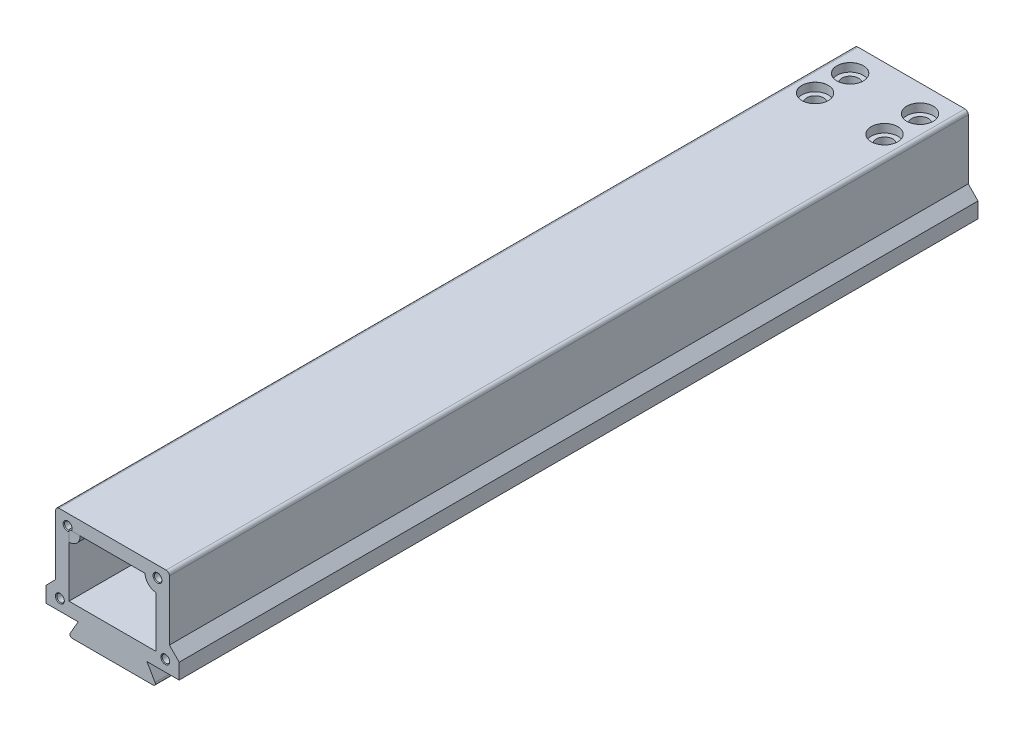
from build123d import *

# Parameters (mm, degrees)
BOSS_EXTRUDE1_DEPTH                     = 720
SKETCH2_W                               = 80.883152422
SKETCH2_H                               = 15.6
CUT_EXTRUDE1_DEPTH                      = 80
CBORE_FOR_M12_HEX_HEAD_BOLT1_AT_2_COUNT = 2
CBORE_FOR_M12_HEX_HEAD_BOLT1_AT_2_PITCH = 63
CBORE_FOR_M12_HEX_HEAD_BOLT2_AT_2_COUNT = 2
CBORE_FOR_M12_HEX_HEAD_BOLT2_AT_2_PITCH = 63.506311734
SKETCH8_W                               = 78.5
SKETCH8_H                               = 56
CUT_EXTRUDE2_DEPTH                      = 640
SKETCH9_W                               = 42.5
SKETCH9_H                               = 56
CUT_EXTRUDE3_DEPTH                      = 90
BOSS_EXTRUDE3_DEPTH                     = 30
M8_TAPPED_HOLE1_D                       = 6.8
M8_TAPPED_HOLE1_DEPTH                   = 19.75
M8_TAPPED_HOLE1_CSINK_D                 = 8.05
M8_TAPPED_HOLE1_CSINK_ANGLE             = 90
M8_TAPPED_HOLE1_TIP                     = 2.042926105
M8_TAPPED_HOLE2_D                       = 6.8
M8_TAPPED_HOLE2_DEPTH                   = 19.75
M8_TAPPED_HOLE2_CSINK_D                 = 8.05
M8_TAPPED_HOLE2_CSINK_ANGLE             = 90
M8_TAPPED_HOLE2_TIP                     = 2.042926105
SKETCH16_W                              = 36
SKETCH16_H                              = 439.976552226
CUT_EXTRUDE4_DEPTH                      = 30
FILLET1_R                               = 15
FILLET2_R                               = 15
FILLET3_R                               = 15
FILLET4_R                               = 15
FILLET5_R                               = 3
FILLET6_R                               = 3
FILLET7_R                               = 2
FILLET8_R                               = 2
BOSS_EXTRUDE4_DEPTH                     = 30


with BuildPart() as part:
    # Sketch1 → Boss-Extrude1 (new body)
    with BuildSketch(Plane.XY):
        Polygon((-39.996837695, 0), (40, 0), (30.993335801, 15.6), (60, 15.6), (60, 29.6), (51.25, 38.6), (51.25, 95.6), (-51.25, 95.6), (-51.25, 38.6), (-60, 29.6), (-60, 15.6), (-30.990173495, 15.6), align=None)
    extrude(amount=BOSS_EXTRUDE1_DEPTH)

    # Sketch2 → Cut-Extrude1 (cut)
    with BuildSketch(Plane(origin=(0, 0, 0), x_dir=(-1, 0, 0), z_dir=(0, 0, -1))):
        with Locations((0.441576211, 7.8)):
            Rectangle(SKETCH2_W, SKETCH2_H)
    extrude(amount=-CUT_EXTRUDE1_DEPTH, mode=Mode.SUBTRACT)

    # Sketch6 → CBORE for M12 Hex Head Bolt1 (revolve, cut)
    with BuildSketch(Plane(origin=(31.75, 95.6, 24), x_dir=(0, 0, 1), z_dir=(1, 0, 0))):
        Polygon((0, 0), (0, 95.6), (7.5, 95.6), (7.5, 7.5), (11.8925, 7.5), (11.8925, 0.025), (11.9175, 0), align=None)
    cbore_for_m12_hex_head_bolt1 = revolve(axis=Axis((31.75, 101.95, 24), (0, -1, 0)), mode=Mode.SUBTRACT)

    # CBORE for M12 Hex Head Bolt1 at 2: CBORE for M12 Hex Head Bolt1 ×2
    with Locations(*[(-i * CBORE_FOR_M12_HEX_HEAD_BOLT1_AT_2_PITCH, 0, 0) for i in range(1, CBORE_FOR_M12_HEX_HEAD_BOLT1_AT_2_COUNT)]):
        add(cbore_for_m12_hex_head_bolt1, mode=Mode.SUBTRACT)

    # Sketch7 → CBORE for M12 Hex Head Bolt2 (revolve, cut)
    with BuildSketch(Plane(origin=(31.75, 95.6, 56), x_dir=(0, 0, 1), z_dir=(1, 0, 0))):
        Polygon((0, 0), (0, 95.6), (7.5, 95.6), (7.5, 7.5), (11.8925, 7.5), (11.8925, 0.025), (11.9175, 0), align=None)
    cbore_for_m12_hex_head_bolt2 = revolve(axis=Axis((31.75, 101.95, 56), (0, -1, 0)), mode=Mode.SUBTRACT)

    # CBORE for M12 Hex Head Bolt2 at 2: CBORE for M12 Hex Head Bolt2 ×2
    with Locations(*[Vector(-0.999900612489988, 0, -0.014098409206251253) * (i * CBORE_FOR_M12_HEX_HEAD_BOLT2_AT_2_PITCH) for i in range(1, CBORE_FOR_M12_HEX_HEAD_BOLT2_AT_2_COUNT)]):
        add(cbore_for_m12_hex_head_bolt2, mode=Mode.SUBTRACT)

    # Sketch8 → Cut-Extrude2 (cut)
    with BuildSketch(Plane.XY.offset(720)):
        with Locations((0, 55.6)):
            Rectangle(SKETCH8_W, SKETCH8_H)
    extrude(amount=-CUT_EXTRUDE2_DEPTH, mode=Mode.SUBTRACT)

    # Sketch9 → Cut-Extrude3 (cut)
    with BuildSketch(Plane.XY.offset(80)):
        with Locations((0, 55.6)):
            Rectangle(SKETCH9_W, SKETCH9_H)
    extrude(amount=-CUT_EXTRUDE3_DEPTH, mode=Mode.SUBTRACT)

    # Sketch12 → Boss-Extrude3 (add)
    with BuildSketch(Plane.XY.offset(720)):
        with BuildLine():
            Line((29.25, 83.6), (39.473976763, 83.823976763))
            Line((39.473976763, 83.823976763), (39.25, 73.6))
            ThreePointArc((39.25, 73.6), (32.242798905, 76.592798905), (29.25, 83.6))
        make_face()
    extrude(amount=-BOSS_EXTRUDE3_DEPTH)

    # M8 Tapped Hole1
    with Locations(Plane(origin=(-40.5, 85.6, 720), x_dir=(1, 0, 0), z_dir=(0, 0, 1))):
        with Locations((0, 0), (81, 0)):
            CounterSinkHole(M8_TAPPED_HOLE1_D / 2, M8_TAPPED_HOLE1_CSINK_D / 2, depth=M8_TAPPED_HOLE1_DEPTH, counter_sink_angle=M8_TAPPED_HOLE1_CSINK_ANGLE)
            with Locations((0, 0, -(M8_TAPPED_HOLE1_DEPTH + M8_TAPPED_HOLE1_TIP / 2))):  # 118° drill point
                Cone(0, M8_TAPPED_HOLE1_D / 2, M8_TAPPED_HOLE1_TIP, mode=Mode.SUBTRACT)

    # M8 Tapped Hole2
    with Locations(Plane(origin=(-47.5, 25.6, 720), x_dir=(1, 0, 0), z_dir=(0, 0, 1))):
        with Locations((0, 0), (95, 0)):
            CounterSinkHole(M8_TAPPED_HOLE2_D / 2, M8_TAPPED_HOLE2_CSINK_D / 2, depth=M8_TAPPED_HOLE2_DEPTH, counter_sink_angle=M8_TAPPED_HOLE2_CSINK_ANGLE)
            with Locations((0, 0, -(M8_TAPPED_HOLE2_DEPTH + M8_TAPPED_HOLE2_TIP / 2))):  # 118° drill point
                Cone(0, M8_TAPPED_HOLE2_D / 2, M8_TAPPED_HOLE2_TIP, mode=Mode.SUBTRACT)

    # Sketch16 → Cut-Extrude4 (cut)
    with BuildSketch(Plane(origin=(0, 0, 0), x_dir=(-1, 0, 0), z_dir=(0, -1, 0))):
        with Locations((0, -439.332055324)):
            Rectangle(SKETCH16_W, SKETCH16_H)
    extrude(amount=-CUT_EXTRUDE4_DEPTH, mode=Mode.SUBTRACT)

    # Fillet1
    fillet1_edges = [part.edges().sort_by_distance(p)[0] for p in [
        (-18, 13.8, 659.320331437),
    ]]
    fillet(fillet1_edges, radius=FILLET1_R)

    # Fillet2
    fillet2_edges = [part.edges().sort_by_distance(p)[0] for p in [
        (18, 13.8, 659.320331437),
    ]]
    fillet(fillet2_edges, radius=FILLET2_R)

    # Fillet3
    fillet3_edges = [part.edges().sort_by_distance(p)[0] for p in [
        (-18, 13.8, 219.343779211),
    ]]
    fillet(fillet3_edges, radius=FILLET3_R)

    # Fillet4
    fillet4_edges = [part.edges().sort_by_distance(p)[0] for p in [
        (18, 13.8, 219.343779211),
    ]]
    fillet(fillet4_edges, radius=FILLET4_R)

    # Fillet5
    fillet5_edges = [part.edges().sort_by_distance(p)[0] for p in [
        (51.25, 95.6, 360),
    ]]
    fillet(fillet5_edges, radius=FILLET5_R)

    # Fillet6
    fillet6_edges = [part.edges().sort_by_distance(p)[0] for p in [
        (-51.25, 95.6, 360),
    ]]
    fillet(fillet6_edges, radius=FILLET6_R)

    # Fillet7
    fillet7_edges = [part.edges().sort_by_distance(p)[0] for p in [
        (40, 0, 400),
    ]]
    fillet(fillet7_edges, radius=FILLET7_R)

    # Fillet8
    fillet8_edges = [part.edges().sort_by_distance(p)[0] for p in [
        (-39.996837695, 0, 400),
    ]]
    fillet(fillet8_edges, radius=FILLET8_R)


with BuildPart() as body_2:
    # Sketch17 → Boss-Extrude4 (new body)
    with BuildSketch(Plane.XY.offset(720)):
        with BuildLine():
            Line((-39.25, 73.6), (-39.25, 83.6))
            Line((-39.25, 83.6), (-29.25, 83.6))
            ThreePointArc((-29.25, 83.6), (-32.178932188, 76.528932188), (-39.25, 73.6))
        make_face()
    extrude(amount=-BOSS_EXTRUDE4_DEPTH)


solid = Compound([part.part, body_2.part])
